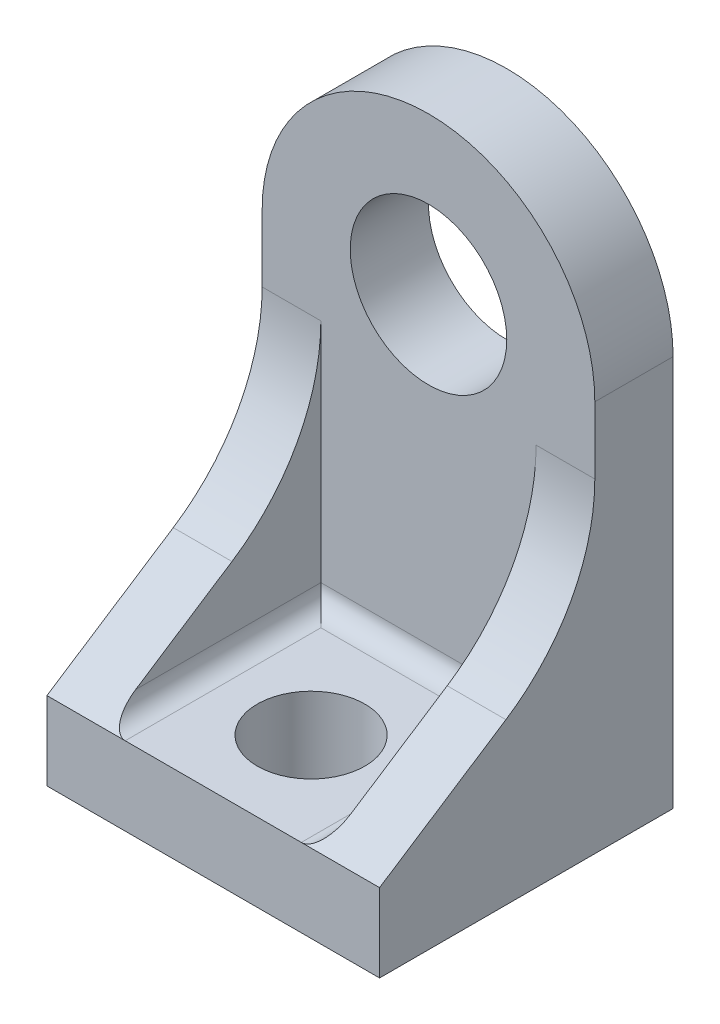
from build123d import *

# Parameters (mm, degrees)
RESSALTO_EXTRUS_O1_DEPTH = 15
CORTE_EXTRUS_O1_START    = -11
CORTE_EXTRUS_O1_DEPTH    = 11
CORTE_EXTRUS_O2_DEPTH    = 37.417715469
FILETE1_R                = 10
FILETE2_R                = 1
FURO_COM_FOLGA_DE_M51_D  = 5.5
ESBO_O7_R                = 4
CORTE_EXTRUS_O3_DEPTH    = 32.709619991


with BuildPart() as part:
    # Esboço1 → Ressalto-extrusão1 (new body)
    with BuildSketch(Plane.XY):
        with BuildLine():
            Line((-8.5, 0), (8.5, 0))
            Line((8.5, 0), (8.5, 20))
            ThreePointArc((8.5, 20), (0, 28.5), (-8.5, 20))
            Line((-8.5, 20), (-8.5, 0))
        make_face()
    extrude(amount=RESSALTO_EXTRUS_O1_DEPTH)

    # Esboço2 → Corte-extrusão1 (cut)
    with BuildSketch(Plane.XY.offset(15).offset(CORTE_EXTRUS_O1_START)):
        with BuildLine():
            Line((-5.5, 4), (5.5, 4))
            Line((5.5, 4), (5.5, 26.480740698))
            ThreePointArc((5.5, 26.480740698), (0, 28.5), (-5.5, 26.480740698))
            Line((-5.5, 26.480740698), (-5.5, 4))
        make_face()
    extrude(amount=CORTE_EXTRUS_O1_DEPTH, mode=Mode.SUBTRACT)

    # Esboço3 → Corte-extrusão2 (cut, through all)
    with BuildSketch(Plane(origin=(8.5, 0, 0), x_dir=(0, 0, -1), z_dir=(1, 0, 0))):
        Polygon((-15, 4), (-4, 11.163154524), (-4, 28.5), (-15, 28.5), align=None)
    extrude(amount=-CORTE_EXTRUS_O2_DEPTH, mode=Mode.SUBTRACT)

    # Filete1
    filete1_edges = [part.edges().sort_by_distance(p)[0] for p in [
        (-7, 11.163154524, 4),
        (7, 11.163154524, 4),
    ]]
    fillet(filete1_edges, radius=FILETE1_R)

    # Filete2
    filete2_edges = [part.edges().sort_by_distance(p)[0] for p in [
        (-5.5, 4, 9.5),
        (0, 4, 4),
        (5.5, 4, 9.5),
    ]]
    fillet(filete2_edges, radius=FILETE2_R)

    # Furo com folga de M51 (through all)
    with Locations(Plane(origin=(0, 4, 0), x_dir=(1, 0, 0), z_dir=(0, 1, 0))):
        with Locations((0, -10)):
            Hole(FURO_COM_FOLGA_DE_M51_D / 2)

    # Esboço7 → Corte-extrusão3 (cut, through all)
    with BuildSketch(Plane.XY.offset(4)):
        with Locations((0, 20.5)):
            Circle(ESBO_O7_R)
    extrude(amount=-CORTE_EXTRUS_O3_DEPTH, mode=Mode.SUBTRACT)


solid = part.part
